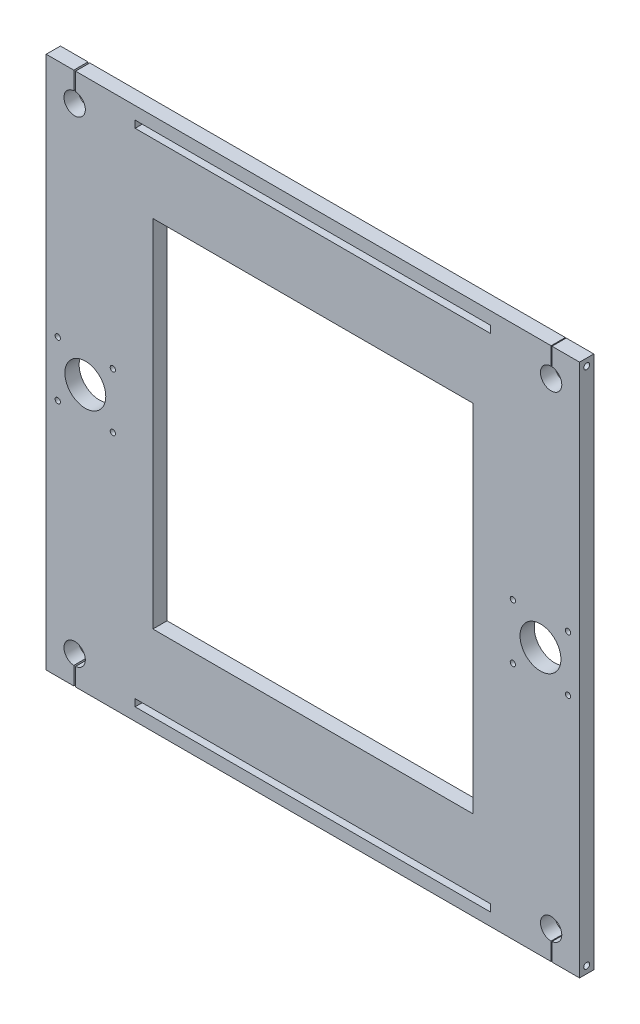
from build123d import *
from build123d.topology import SkipClean

# Parameters (mm, degrees)
SKETCH1_R                       = 1.5
SKETCH1_W                       = 200
SKETCH1_H                       = 4
BOSS_EXTRUDE1_DEPTH             = 8
M4_TAPPED_HOLE1_D               = 3.3
M4_TAPPED_HOLE1_DEPTH           = 25
M4_TAPPED_HOLE1_TIP             = 0.991420021
M4_TAPPED_HOLE1_ON_FACE_2_D     = 3.3
M4_TAPPED_HOLE1_ON_FACE_2_DEPTH = 25
M4_TAPPED_HOLE1_ON_FACE_2_TIP   = 0.991420021


with BuildPart() as part:
    # Sketch1 → Boss-Extrude1 (new body)
    with BuildSketch(Plane.XY):
        with BuildLine():
            Line((179.658803725, 93.087327907), (179.658803725, -6.912672093))
            Line((179.658803725, -6.912672093), (206.158803725, -6.912672093))
            ThreePointArc((206.158803725, -6.912672093), (217.658803725, 4.587327907), (229.158803725, -6.912672093))
            Line((229.158803725, -6.912672093), (239.658803725, -6.912672093))
            Line((239.658803725, -6.912672093), (239.658803725, 143.087327907))
            Line((239.658803725, 143.087327907), (224.158803725, 143.087327907))
            Line((224.158803725, 143.087327907), (224.158803725, 133.066458278))
            ThreePointArc((224.158803725, 133.066458278), (223.408586049, 121.092547584), (223.658803725, 133.087327907))
            Line((223.658803725, 133.087327907), (223.658803725, 143.087327907))
            Line((223.658803725, 143.087327907), (-43.841196275, 143.087327907))
            Line((-43.841196275, 143.087327907), (-43.841196275, 133.066458278))
            ThreePointArc((-43.841196275, 133.066458278), (-44.341196275, 121.087327907), (-44.841196275, 133.066458278))
            Line((-44.841196275, 133.066458278), (-44.841196275, 143.087327907))
            Line((-44.841196275, 143.087327907), (-60.341196275, 143.087327907))
            Line((-60.341196275, 143.087327907), (-60.341196275, -6.912672093))
            Line((-60.341196275, -6.912672093), (-49.841196275, -6.912672093))
            ThreePointArc((-49.841196275, -6.912672093), (-38.341196275, 4.587327907), (-26.841196275, -6.912672093))
            Line((-26.841196275, -6.912672093), (-0.341196275, -6.912672093))
            Line((-0.341196275, -6.912672093), (-0.341196275, 93.087327907))
            Line((-0.341196275, 93.087327907), (179.658803725, 93.087327907))
        make_face()
        with Locations((-53.841196275, 8.587327907)):
            Circle(SKETCH1_R, mode=Mode.SUBTRACT)
        with Locations((-22.841196275, 8.587327907)):
            Circle(SKETCH1_R, mode=Mode.SUBTRACT)
        with Locations((233.158803725, 8.587327907)):
            Circle(SKETCH1_R, mode=Mode.SUBTRACT)
        with Locations((202.158803725, 8.587327907)):
            Circle(SKETCH1_R, mode=Mode.SUBTRACT)
        with Locations((89.658803725, 134)):
            Rectangle(SKETCH1_W, SKETCH1_H, mode=Mode.SUBTRACT)
    boss_extrude1 = extrude(amount=BOSS_EXTRUDE1_DEPTH)

    # Mirror1: Boss-Extrude1 across plane
    with SkipClean():  # the faces are left unmerged after this step: merging them gives an invalid solid
        add(boss_extrude1.mirror(Plane(origin=(0, -6.912672093, 8), x_dir=(0, 0, 1), z_dir=(0, 1, 0))))

    # M4 Tapped Hole1
    with Locations(Plane(origin=(-60.341196275, -152.912672093, 4), x_dir=(0, 0, -1), z_dir=(-1, 0, 0))):
        with Locations((0, 0), (0, -292)):
            Hole(M4_TAPPED_HOLE1_D / 2, depth=M4_TAPPED_HOLE1_DEPTH)
            with Locations((0, 0, -(M4_TAPPED_HOLE1_DEPTH + M4_TAPPED_HOLE1_TIP / 2))):  # 118° drill point
                Cone(0, M4_TAPPED_HOLE1_D / 2, M4_TAPPED_HOLE1_TIP, mode=Mode.SUBTRACT)

    # M4 Tapped Hole1 on face 2
    with Locations(Plane(origin=(239.658803725, -152.912672093, 4), x_dir=(0, 0, 1), z_dir=(1, 0, 0))):
        with Locations((0, 0), (0, -292)):
            Hole(M4_TAPPED_HOLE1_ON_FACE_2_D / 2, depth=M4_TAPPED_HOLE1_ON_FACE_2_DEPTH)
            with Locations((0, 0, -(M4_TAPPED_HOLE1_ON_FACE_2_DEPTH + M4_TAPPED_HOLE1_ON_FACE_2_TIP / 2))):  # 118° drill point
                Cone(0, M4_TAPPED_HOLE1_ON_FACE_2_D / 2, M4_TAPPED_HOLE1_ON_FACE_2_TIP, mode=Mode.SUBTRACT)


solid = part.part
